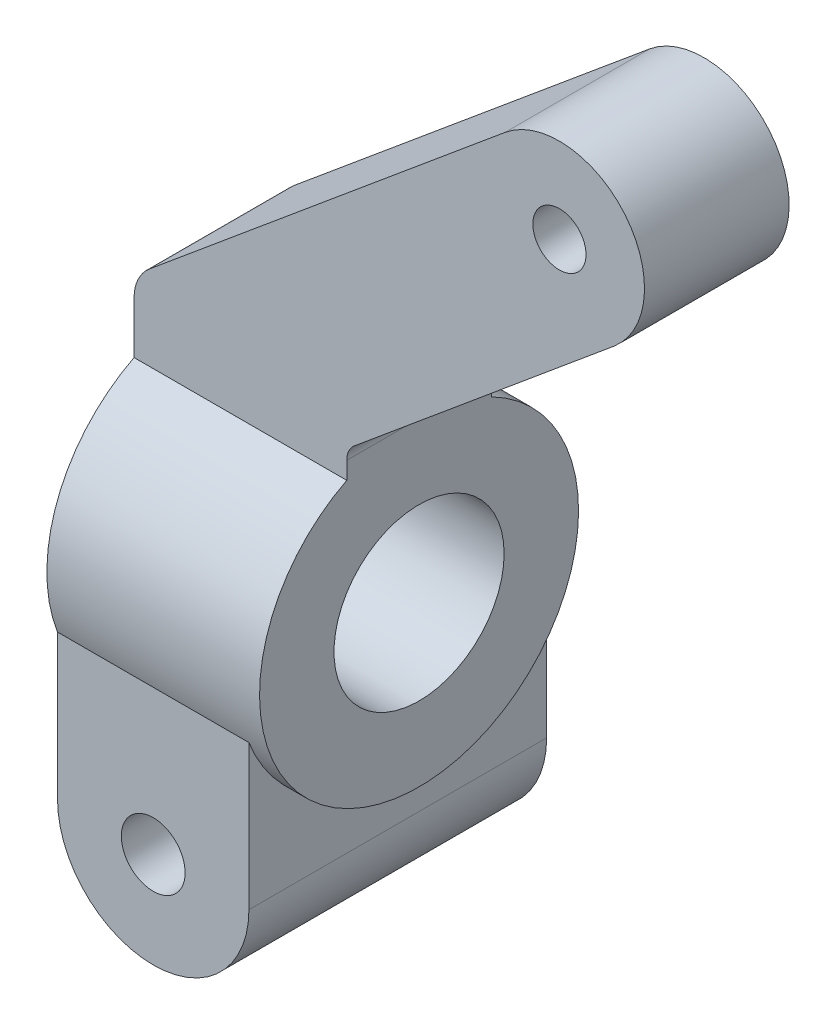
from build123d import *

# Parameters (mm, degrees)
SKETCH1_R               = 7.5
BOSS_EXTRUDE1_DEPTH     = 10
BOSS_EXTRUDE2_DEPTH     = 3.4
BOSS_EXTRUDE3_DEPTH     = 7
CUT_EXTRUDE1_DEPTH      = 38.901187316
CUT_EXTRUDE1_DEPTH_BACK = 38.901187316
SKETCH4_R               = 1.5
SKETCH5_R               = 4
CUT_EXTRUDE2_DEPTH      = 31.041637772
CUT_EXTRUDE3_DEPTH      = 37.675059645
CUT_EXTRUDE3_DEPTH_BACK = 37.675059645
SKETCH6_R               = 1.25


with BuildPart() as part:
    # Sketch1 → Boss-Extrude1 (new body)
    with BuildSketch(Plane(origin=(0, 0, 0), x_dir=(0, 0, -1), z_dir=(1, 0, 0))):
        Circle(SKETCH1_R)
    extrude(amount=BOSS_EXTRUDE1_DEPTH)

    # Sketch2 → Boss-Extrude2 (add, symmetric)
    with BuildSketch(Plane.XY):
        with BuildLine():
            Line((0, 0), (0, 9.115122314))
            ThreePointArc((0, 9.115122314), (0.188996508, 9.963807387), (0.720266353, 10.652093944))
            Line((0.720266353, 10.652093944), (17.440532706, 24.573943261))
            ThreePointArc((17.440532706, 24.573943261), (23.073943261, 24.059467294), (22.559467294, 18.426056739))
            Line((22.559467294, 18.426056739), (10.360133176, 8.268485815))
            ThreePointArc((10.360133176, 8.268485815), (10.094498254, 7.924342536), (10, 7.5))
            Line((10, 7.5), (10, 0))
            Line((10, 0), (0, 0))
        make_face()
    extrude(amount=BOSS_EXTRUDE2_DEPTH, both=True)

    # Sketch3 → Boss-Extrude3 (add, symmetric)
    with BuildSketch(Plane.XY):
        with BuildLine():
            Line((9, -9.5), (9, 0))
            Line((9, 0), (0, 0))
            Line((0, 0), (0, -9.5))
            ThreePointArc((0, -9.5), (4.5, -14), (9, -9.5))
        make_face()
    extrude(amount=BOSS_EXTRUDE3_DEPTH, both=True)

    # Sketch4 → Cut-Extrude1 (cut, two sides: drawn at the far end of the back side and taken through both)
    with BuildSketch(Plane.XY.offset(7).offset(-CUT_EXTRUDE1_DEPTH_BACK)):
        with Locations((4.5, -9.5)):
            Circle(SKETCH4_R)
    extrude(amount=CUT_EXTRUDE1_DEPTH + CUT_EXTRUDE1_DEPTH_BACK, mode=Mode.SUBTRACT)

    # Sketch5 → Cut-Extrude2 (cut, through all)
    with BuildSketch(Plane(origin=(10, 0, 0), x_dir=(0, 0, -1), z_dir=(1, 0, 0))):
        Circle(SKETCH5_R)
    extrude(amount=-CUT_EXTRUDE2_DEPTH, mode=Mode.SUBTRACT)

    # Sketch6 → Cut-Extrude3 (cut, two sides: drawn at the far end of the back side and taken through both)
    with BuildSketch(Plane.XY.offset(3.4).offset(-CUT_EXTRUDE3_DEPTH_BACK)):
        with Locations((20, 21.5)):
            Circle(SKETCH6_R)
    extrude(amount=CUT_EXTRUDE3_DEPTH + CUT_EXTRUDE3_DEPTH_BACK, mode=Mode.SUBTRACT)


solid = part.part
